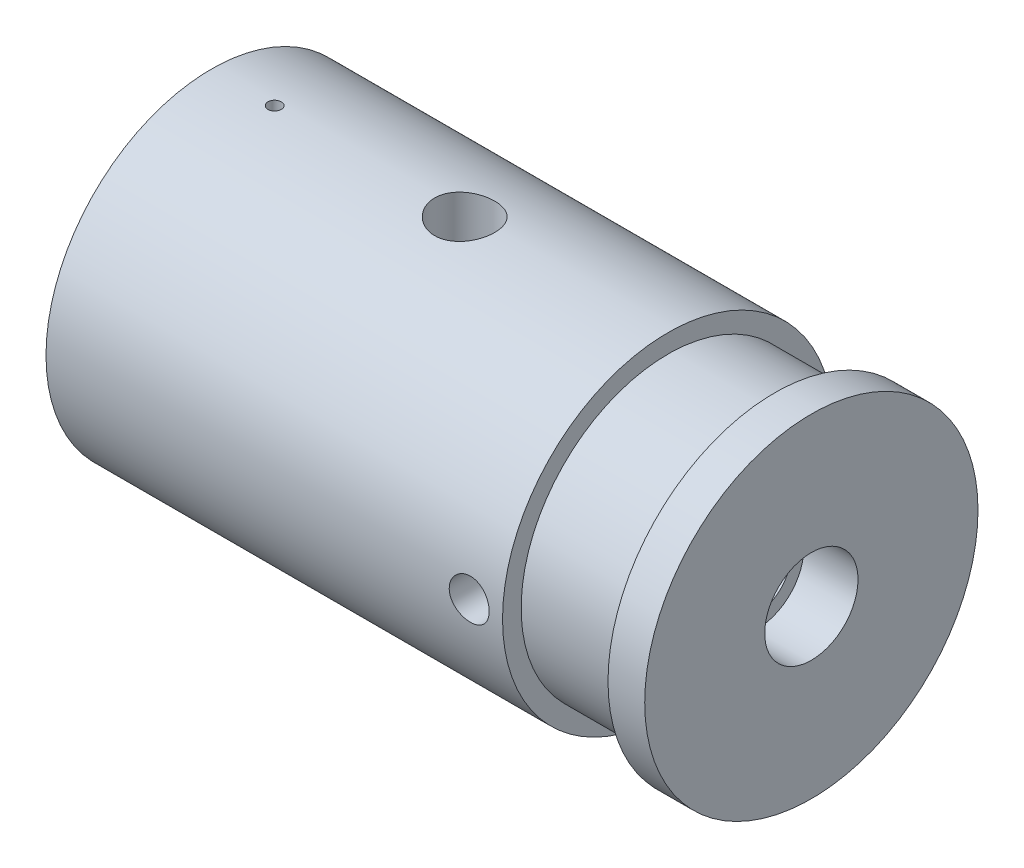
from build123d import *

# Parameters (mm, degrees)
CUT_EXTRUDE1_DEPTH      = 21
CUT_EXTRUDE1_DEPTH_BACK = 22
SKETCH4_R               = 1.7
SKETCH5_R               = 1
CUT_EXTRUDE2_DEPTH      = 32
CUT_EXTRUDE3_DEPTH      = 106.948100502
CUT_EXTRUDE3_DEPTH_BACK = 61
SKETCH7_R               = 1.7
SKETCH8_R               = 1.7
CUT_EXTRUDE4_DEPTH      = 25
SKETCH9_R               = 1
CUT_EXTRUDE5_DEPTH      = 25
SKETCH10_R              = 4.5
CUT_EXTRUDE6_DEPTH      = 10
SKETCH11_R              = 3
CUT_EXTRUDE7_DEPTH      = 13


with BuildPart() as part:
    # Sketch1 → Revolve1 (revolve)
    with BuildSketch(Plane.XY):
        Polygon((0, 0), (0, 24.820612545), (68.489462458, 24.820612545), (68.489462458, 22.028059354), (84.491973548, 22.028059354), (84.491973548, 25), (90, 25), (90, 0), align=None)
    revolve(axis=Axis((0, 0, 0), (-1, 0, 0)))

    # Sketch3 → Cut-Revolve1 (revolve, cut)
    with BuildSketch(Plane(origin=(0, 0, 0), x_dir=(1, 0, 0), z_dir=(0, 1, 0))):
        Polygon((0, 0), (0, 13), (11.186820081, 13), (11.186820081, 11), (14.393242315, 11), (14.393242315, 9), (69.922645544, 9), (69.922645544, 5), (81.873855688, 5), (81.873855688, 7), (90, 7), (90, 0), align=None)
    revolve(axis=Axis((96.448502204, 0, 0), (-1, 0, 0)), mode=Mode.SUBTRACT)

    # Sketch4 → Cut-Extrude1 (cut, two sides: drawn at the far end of the back side and taken through both)
    with BuildSketch(Plane.XY.offset(-CUT_EXTRUDE1_DEPTH_BACK)):
        with Locations((38.043963981, 0)):
            Circle(SKETCH4_R)
    extrude(amount=CUT_EXTRUDE1_DEPTH + CUT_EXTRUDE1_DEPTH_BACK, mode=Mode.SUBTRACT)

    # Sketch5 → Cut-Extrude2 (cut)
    with BuildSketch(Plane.XY):
        with Locations((10.543963981, 0)):
            Circle(SKETCH5_R)
    extrude(amount=-CUT_EXTRUDE2_DEPTH, mode=Mode.SUBTRACT)

    # Sketch7 → Cut-Extrude3 (cut, two sides: drawn at the far end of the back side and taken through both)
    with BuildSketch(Plane(origin=(0, 25, 0), x_dir=(1, 0, 0), z_dir=(0, 1, 0)).offset(-CUT_EXTRUDE3_DEPTH_BACK)):
        with Locations((37.989462458, 0)):
            Circle(SKETCH7_R)
    extrude(amount=CUT_EXTRUDE3_DEPTH + CUT_EXTRUDE3_DEPTH_BACK, mode=Mode.SUBTRACT)

    # Sketch8 → Cut-Extrude4 (cut)
    with BuildSketch(Plane.XY.offset(25)):
        with Locations((63.489462458, 0)):
            Circle(SKETCH8_R)
    extrude(amount=-CUT_EXTRUDE4_DEPTH, mode=Mode.SUBTRACT)

    # Sketch9 → Cut-Extrude5 (cut)
    with BuildSketch(Plane(origin=(0, 25, 0), x_dir=(1, 0, 0), z_dir=(0, 1, 0))):
        with Locations((9.489462458, 0)):
            Circle(SKETCH9_R)
    extrude(amount=-CUT_EXTRUDE5_DEPTH, mode=Mode.SUBTRACT)

    # Sketch10 → Cut-Extrude6 (cut)
    with BuildSketch(Plane(origin=(0, 25, 0), x_dir=(1, 0, 0), z_dir=(0, 1, 0))):
        with Locations((37.989462458, 0)):
            Circle(SKETCH10_R)
    cut_extrude6 = extrude(amount=-CUT_EXTRUDE6_DEPTH, mode=Mode.SUBTRACT)

    # Mirror1: Cut-Extrude6 across plane
    add(cut_extrude6.mirror(Plane.ZX), mode=Mode.SUBTRACT)

    # Sketch11 → Cut-Extrude7 (cut)
    with BuildSketch(Plane.XY.offset(25)):
        with Locations((63.489462458, 0)):
            Circle(SKETCH11_R)
    extrude(amount=-CUT_EXTRUDE7_DEPTH, mode=Mode.SUBTRACT)


solid = part.part
